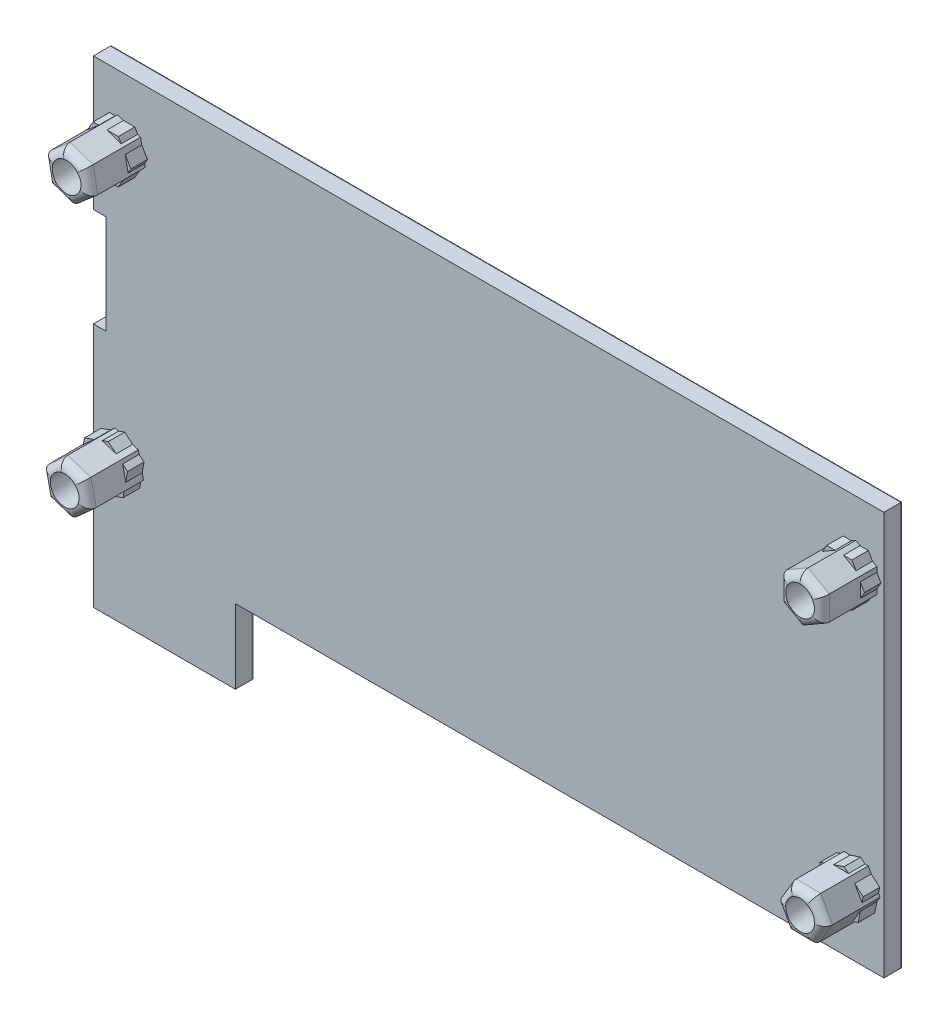
from build123d import *

# Parameters (mm, degrees)
BACK_COVER_DEPTH        = 2.25
SKETCH5_W               = 1.5
SKETCH5_H               = 12
OPENER_ACCESS_DEPTH     = 10
FILLET1_R               = 0.2
SNAP_IN_DEPTH           = 9
SNAP_IN_2_DEPTH         = 2
SNAP_IN_EDGE_ROUNDING_R = 1
SKETCH4_R               = 1.74089686
SKETCH4_R_2             = 1.74
HOLLOW_SNAP_IN_DEPTH    = 3


with BuildPart() as part:
    # Sketch1 → back cover (new body)
    with BuildSketch(Plane(origin=(0, 0, 44.244836639), x_dir=(-1, 0, 0), z_dir=(0, 0, -1))):
        Polygon((19.478093322, 63.361389577), (19.478093322, 54.4), (2.278093322, 54.4), (2.278093322, 63.4), (-76.325960347, 63.4), (-76.325960347, 112.278076297), (19.478093322, 112.278076297), align=None)
    extrude(amount=-BACK_COVER_DEPTH)

    # Sketch5 → opener access (cut)
    with BuildSketch(Plane(origin=(0, 0, 44.244836639), x_dir=(-1, 0, 0), z_dir=(0, 0, -1))):
        with Locations((18.728093322, 90.153525736)):
            Rectangle(SKETCH5_W, SKETCH5_H)
    extrude(amount=-OPENER_ACCESS_DEPTH, mode=Mode.SUBTRACT)

    # Fillet1
    fillet1_edges = [part.edges().sort_by_distance(p)[0] for p in [
        (-19.478093322, 104.215801016, 44.244836639),
        (-18.728093322, 96.153525736, 44.244836639),
        (-17.978093322, 90.153525736, 44.244836639),
        (-18.728093322, 84.153525736, 44.244836639),
        (37.023933512, 63.4, 44.244836639),
        (76.325960347, 87.839038148, 44.244836639),
        (28.423933512, 112.278076297, 44.244836639),
        (-19.478093322, 69.276762868, 44.244836639),
        (-10.878093322, 54.4, 44.244836639),
        (-2.278093322, 58.9, 44.244836639),
    ]]
    fillet(fillet1_edges, radius=FILLET1_R)

    # Sketch2 → snap in (add)
    with BuildSketch(Plane(origin=(0, 0, 44.244836639), x_dir=(-1, 0, 0), z_dir=(0, 0, -1))):
        Polygon((-72.910960347, 107.628336172), (-75.465960347, 106.153206235), (-75.465960347, 103.202946359), (-72.910960347, 101.727816421), (-70.355960347, 103.202946359), (-70.355960347, 106.153206235), align=None)
        Polygon((-74.422966766, 74.211427817), (-75.860910329, 71.635316088), (-74.348903911, 69.101964568), (-71.398953929, 69.144724777), (-69.961010365, 71.720836506), (-71.473016783, 74.254188026), align=None)
        Polygon((16.840439102, 74.561948451), (14.031759479, 73.658979951), (13.409413327, 70.775107798), (15.595746797, 68.794204143), (18.40442642, 69.697172642), (19.026772572, 72.581044796), align=None)
        Polygon((16.547378626, 107.575021399), (13.759381088, 106.610084583), (13.201042114, 103.713139481), (15.43070068, 101.781131195), (18.218698218, 102.746068011), (18.777037191, 105.643013113), align=None)
    extrude(amount=-SNAP_IN_DEPTH)

    # Sketch6 → snap in 2 (add)
    with BuildSketch(Plane(origin=(0, 0, 46.494836639), x_dir=(-1, 0, 0), z_dir=(0, 0, -1))):
        Polygon((-75.970916774, 104.678076297), (-74.440938561, 102.028076297), (-71.380982134, 102.028076297), (-69.851003921, 104.678076297), (-71.380982134, 107.328076297), (-74.440938561, 107.328076297), align=None)
        Polygon((-75.809392477, 72.659108671), (-75.209775371, 69.658476628), (-72.31134324, 68.677444254), (-70.012528217, 70.697043922), (-70.612145324, 73.697675965), (-73.510577454, 74.67870834), align=None)
        Polygon((15.686737092, 74.69154511), (13.342674475, 72.724643032), (13.874030333, 69.71117422), (16.749448807, 68.664607484), (19.093511424, 70.631509561), (18.562155566, 73.644978374), align=None)
        Polygon((12.929083226, 104.678076297), (14.459061439, 102.028076297), (17.519017866, 102.028076297), (19.048996079, 104.678076297), (17.519017866, 107.328076297), (14.459061439, 107.328076297), align=None)
    extrude(amount=-SNAP_IN_2_DEPTH)

    # snap in edge rounding
    snap_in_edge_rounding_edges = [part.edges().sort_by_distance(p)[0] for p in [
        (72.947991775, 74.232807921, 53.244836639),
        (70.717013574, 72.987512266, 53.244836639),
        (70.679982147, 70.432780641, 53.244836639),
        (72.87392892, 69.123344672, 53.244836639),
        (75.10490712, 70.368640328, 53.244836639),
        (75.141938548, 72.923371952, 53.244836639),
        (-17.933605837, 73.571496623, 53.244836639),
        (-18.715599496, 71.139108719, 53.244836639),
        (-17.000086609, 69.245688393, 53.244836639),
        (-14.502580062, 69.78465597, 53.244836639),
        (-13.720586403, 72.217043875, 53.244836639),
        (-15.43609929, 74.110464201, 53.244836639),
        (-17.662207909, 106.609017256, 53.244836639),
        (-18.497867705, 104.194540562, 53.244836639),
        (-16.824699449, 102.263599603, 53.244836639),
        (-14.315871397, 102.747135338, 53.244836639),
        (-13.480211601, 105.161612032, 53.244836639),
        (-15.153379857, 107.092552991, 53.244836639),
        (71.633460347, 106.890771204, 53.244836639),
        (70.355960347, 104.678076297, 53.244836639),
        (71.633460347, 102.46538139, 53.244836639),
        (74.188460347, 102.46538139, 53.244836639),
        (75.465960347, 104.678076297, 53.244836639),
        (74.188460347, 106.890771204, 53.244836639),
    ]]
    fillet(snap_in_edge_rounding_edges, radius=SNAP_IN_EDGE_ROUNDING_R)

    # Sketch4 → hollow snap in (cut)
    with BuildSketch(Plane.XY.offset(53.244836639)):
        with Locations((-15.989039653, 104.678076297)):
            Circle(SKETCH4_R)
        with Locations((72.910960347, 104.678076297)):
            Circle(SKETCH4_R_2)
        with Locations((-16.21809295, 71.678076297)):
            Circle(SKETCH4_R_2)
        with Locations((72.910960347, 71.678076297)):
            Circle(SKETCH4_R_2)
    extrude(amount=-HOLLOW_SNAP_IN_DEPTH, mode=Mode.SUBTRACT)


solid = part.part
